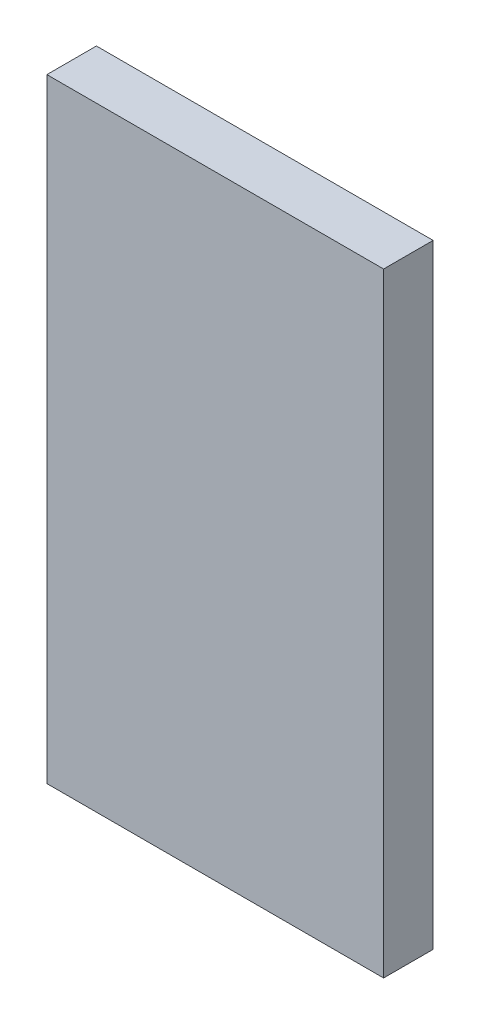
from build123d import *

# Parameters (mm, degrees)
ESQUISSE1_W        = 34
ESQUISSE1_H        = 62
BOSS_EXTRU_1_DEPTH = 5


with BuildPart() as part:
    # Esquisse1 → Boss.-Extru.1 (new body)
    with BuildSketch(Plane.XY):
        with Locations((2.972200028, -22.151260504)):
            Rectangle(ESQUISSE1_W, ESQUISSE1_H)
    extrude(amount=BOSS_EXTRU_1_DEPTH)


solid = part.part
